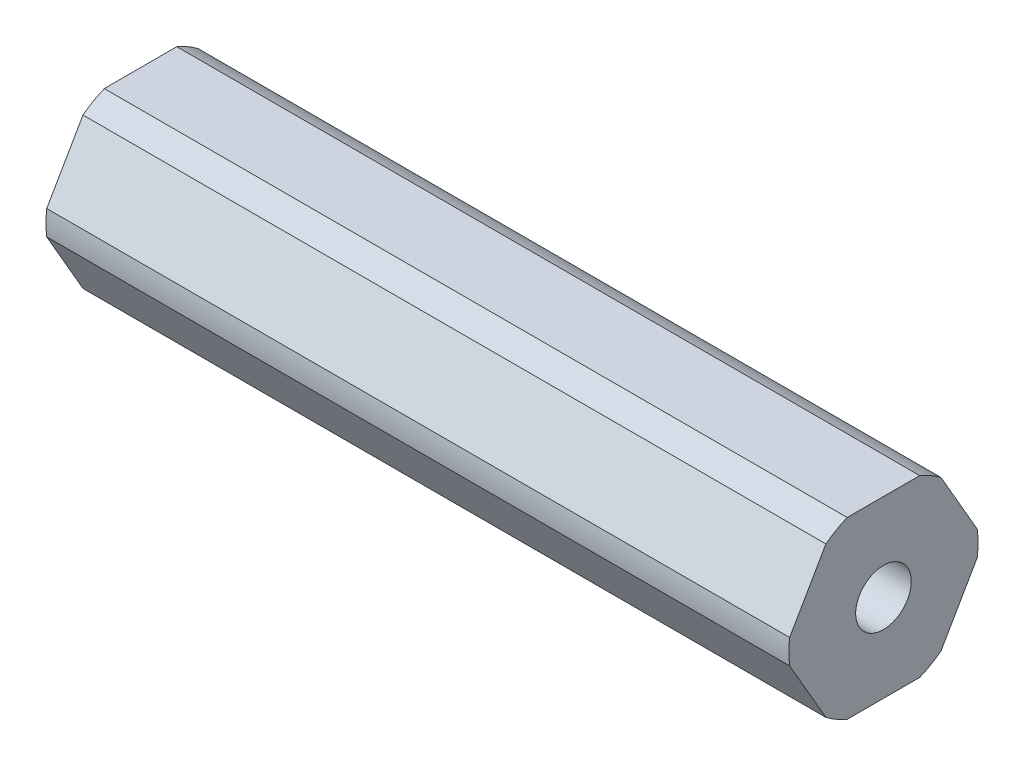
from build123d import *

# Parameters (mm, degrees)
SKETCH1_R           = 2.0193
BOSS_EXTRUDE1_DEPTH = 26.9875


with BuildPart() as part:
    # Sketch1 → Boss-Extrude1 (new, symmetric)
    with BuildSketch(Plane(origin=(0, 0, 0), x_dir=(0, 0, -1), z_dir=(1, 0, 0))):
        with BuildLine():
            ThreePointArc((6.874999966, 0), (6.860422465, 0.447468582), (6.816751782, 0.893039571))
            Line((6.816751782, 0.893039571), (4.181770846, 5.456960429))
            ThreePointArc((4.181770846, 5.456960429), (3.437499983, 5.953924622), (2.634980936, 6.35))
            Line((2.634980936, 6.35), (-2.634980936, 6.35))
            ThreePointArc((-2.634980936, 6.35), (-3.437499983, 5.953924622), (-4.181770846, 5.456960429))
            Line((-4.181770846, 5.456960429), (-6.816751782, 0.893039571))
            ThreePointArc((-6.816751782, 0.893039571), (-6.874999966, 0), (-6.816751782, -0.893039571))
            Line((-6.816751782, -0.893039571), (-4.181770846, -5.456960429))
            ThreePointArc((-4.181770846, -5.456960429), (-3.437499983, -5.953924622), (-2.634980936, -6.35))
            Line((-2.634980936, -6.35), (2.634980936, -6.35))
            ThreePointArc((2.634980936, -6.35), (3.437499983, -5.953924622), (4.181770846, -5.456960429))
            Line((4.181770846, -5.456960429), (6.816751782, -0.893039571))
            ThreePointArc((6.816751782, -0.893039571), (6.860422465, -0.447468582), (6.874999966, 0))
        make_face()
        Circle(SKETCH1_R, mode=Mode.SUBTRACT)
    extrude(amount=BOSS_EXTRUDE1_DEPTH, both=True)


solid = part.part
